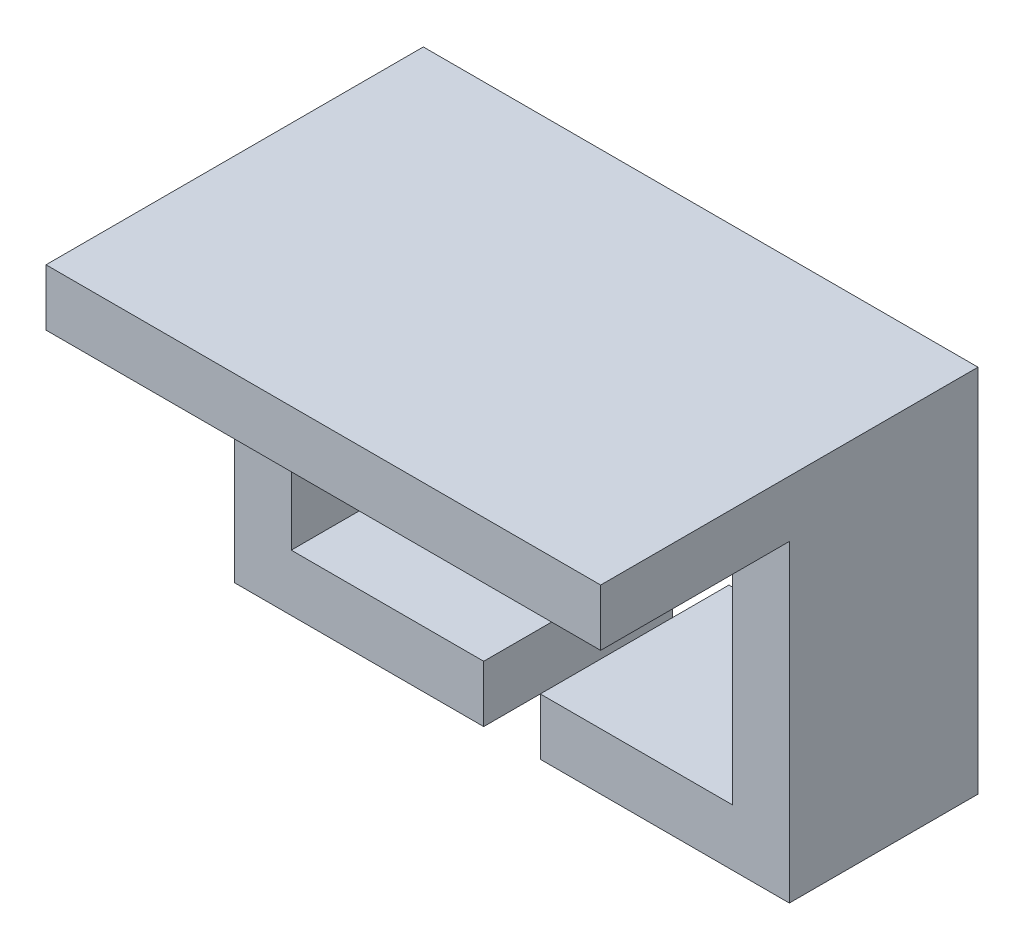
from build123d import *

# Parameters (mm, degrees)
EXTRUDE_458_DEPTH = 5
SKETCH_2_W        = 14.7
SKETCH_2_H        = 1.5
EXTRUDE_744_DEPTH = 5


with BuildPart() as part:
    # Эскиз1 → Extrude 458 (new body)
    with BuildSketch(Plane.XY):
        Polygon((-7.35, 4.9), (-7.35, -4.9), (-0.75, -4.9), (-0.75, -3.4), (-5.85, -3.4), (-5.85, 3.4), (5.85, 3.4), (5.85, -3.4), (0.75, -3.4), (0.75, -4.9), (7.35, -4.9), (7.35, 4.9), align=None)
    extrude(amount=EXTRUDE_458_DEPTH)

    # Эскиз2 → Extrude 744 (add)
    with BuildSketch(Plane.XY.offset(5)):
        with Locations((0, 4.15)):
            Rectangle(SKETCH_2_W, SKETCH_2_H)
    extrude(amount=EXTRUDE_744_DEPTH)


solid = part.part
